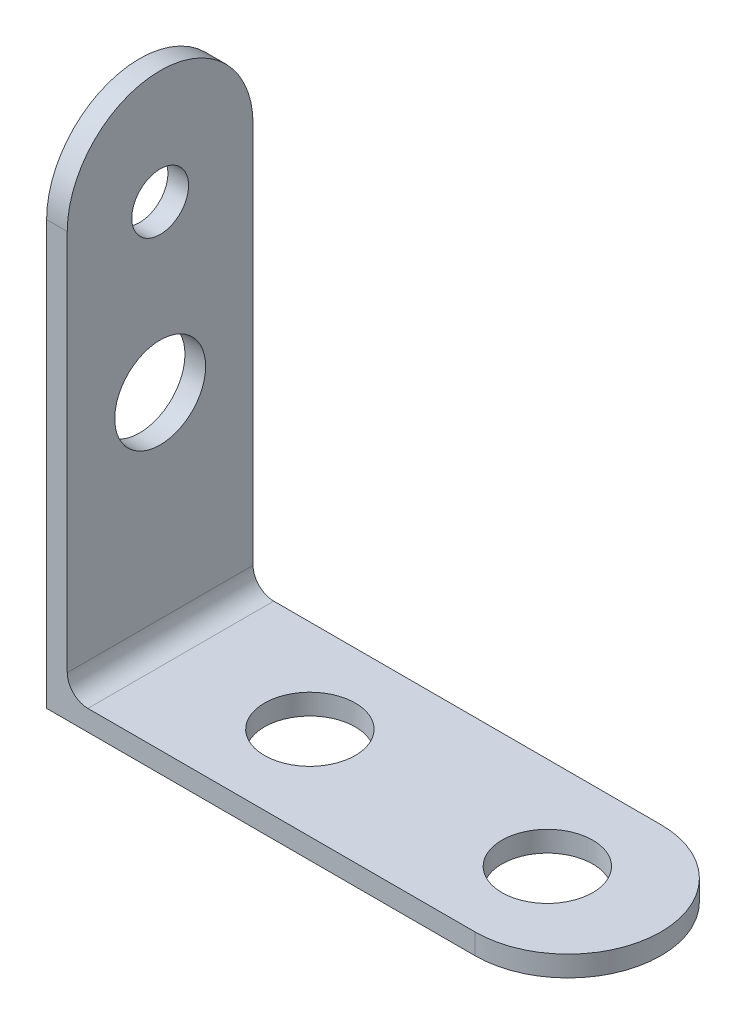
from build123d import *

# Parameters (mm, degrees)
EXTRUDE_1_DEPTH     = 18
FILLET_1_R          = 2
SKETCH_2_R          = 4.4
SKETCH_2_R_2        = 2.75
CUT_EXTRUDE_1_DEPTH = 10
SKETCH_3_R          = 4.4
CUT_EXTRUDE_2_DEPTH = 10


with BuildPart() as part:
    # 草图1 → 凸台-拉伸1 (new body)
    with BuildSketch(Plane.XY):
        Polygon((0, 0), (-48.5, 0), (-48.5, 48), (-50.5, 48), (-50.5, -2), (0, -2), align=None)
    extrude(amount=EXTRUDE_1_DEPTH)

    # 圆角1
    fillet_1_edges = [part.edges().sort_by_distance(p)[0] for p in [
        (-48.5, 0, 9),
    ]]
    fillet(fillet_1_edges, radius=FILLET_1_R)

    # 草图2 → 切除-拉伸1 (cut)
    with BuildSketch(Plane(origin=(-48.5, 0, 0), x_dir=(0, 0, -1), z_dir=(1, 0, 0))):
        with BuildLine():
            Line((-9, 48), (-18, 48))
            Line((-18, 48), (-18, 39))
            ThreePointArc((-18, 39), (-15.363961031, 45.363961031), (-9, 48))
        make_face()
        with Locations((-9, 21)):
            Circle(SKETCH_2_R)
        with Locations((-9, 37)):
            Circle(SKETCH_2_R_2)
        with BuildLine():
            Line((0, 48), (-9, 48))
            ThreePointArc((-9, 48), (-2.636038969, 45.363961031), (0, 39))
            Line((0, 39), (0, 48))
        make_face()
    extrude(amount=-CUT_EXTRUDE_1_DEPTH, mode=Mode.SUBTRACT)

    # 草图3 → 切除-拉伸2 (cut)
    with BuildSketch(Plane(origin=(0, 0, 0), x_dir=(1, 0, 0), z_dir=(0, 1, 0))):
        with BuildLine():
            Line((0, -9), (0, 0))
            Line((0, 0), (-9, 0))
            ThreePointArc((-9, 0), (-2.636038969, -2.636038969), (0, -9))
        make_face()
        with Locations(Location((-34, -9, 0), (0, 0, 270))):
            Circle(SKETCH_3_R)
        with Locations(Location((-11, -9, 0), (0, 0, 270))):
            Circle(SKETCH_3_R)
        with BuildLine():
            Line((0, -18), (0, -9))
            ThreePointArc((0, -9), (-2.636038969, -15.363961031), (-9, -18))
            Line((-9, -18), (0, -18))
        make_face()
    extrude(amount=-CUT_EXTRUDE_2_DEPTH, mode=Mode.SUBTRACT)


solid = part.part
